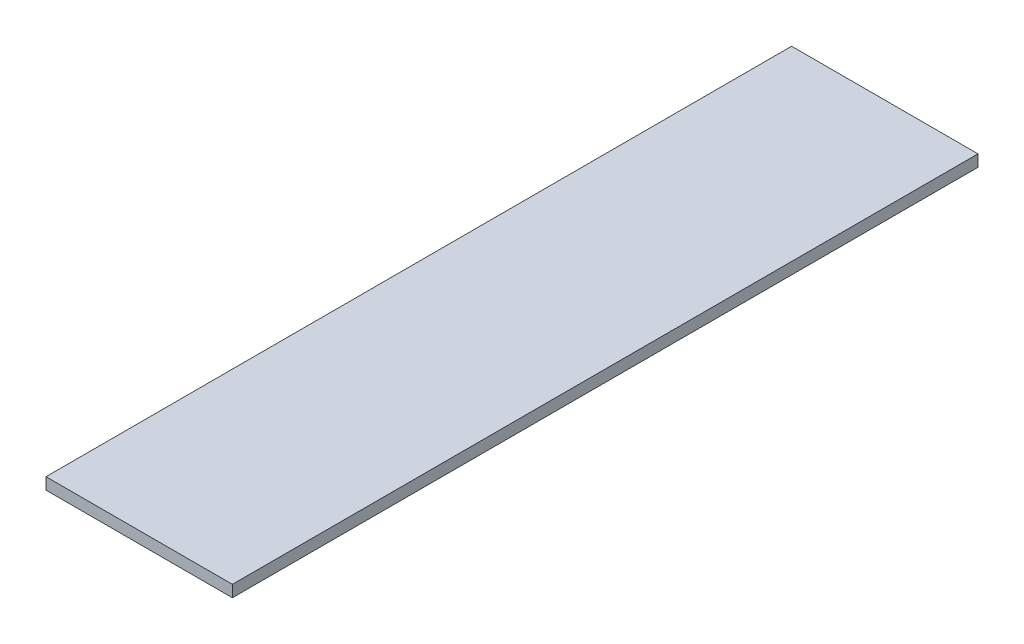
from build123d import *

# Parameters (mm, degrees)
SKETCH1_W           = 50.8
SKETCH1_H           = 203.2
BOSS_EXTRUDE1_DEPTH = 3.175


with BuildPart() as part:
    # Sketch1 → Boss-Extrude1 (new body)
    with BuildSketch(Plane(origin=(0, 0, 0), x_dir=(1, 0, 0), z_dir=(0, 1, 0))):
        with Locations((25.4, 101.6)):
            Rectangle(SKETCH1_W, SKETCH1_H)
    extrude(amount=BOSS_EXTRUDE1_DEPTH)


solid = part.part
